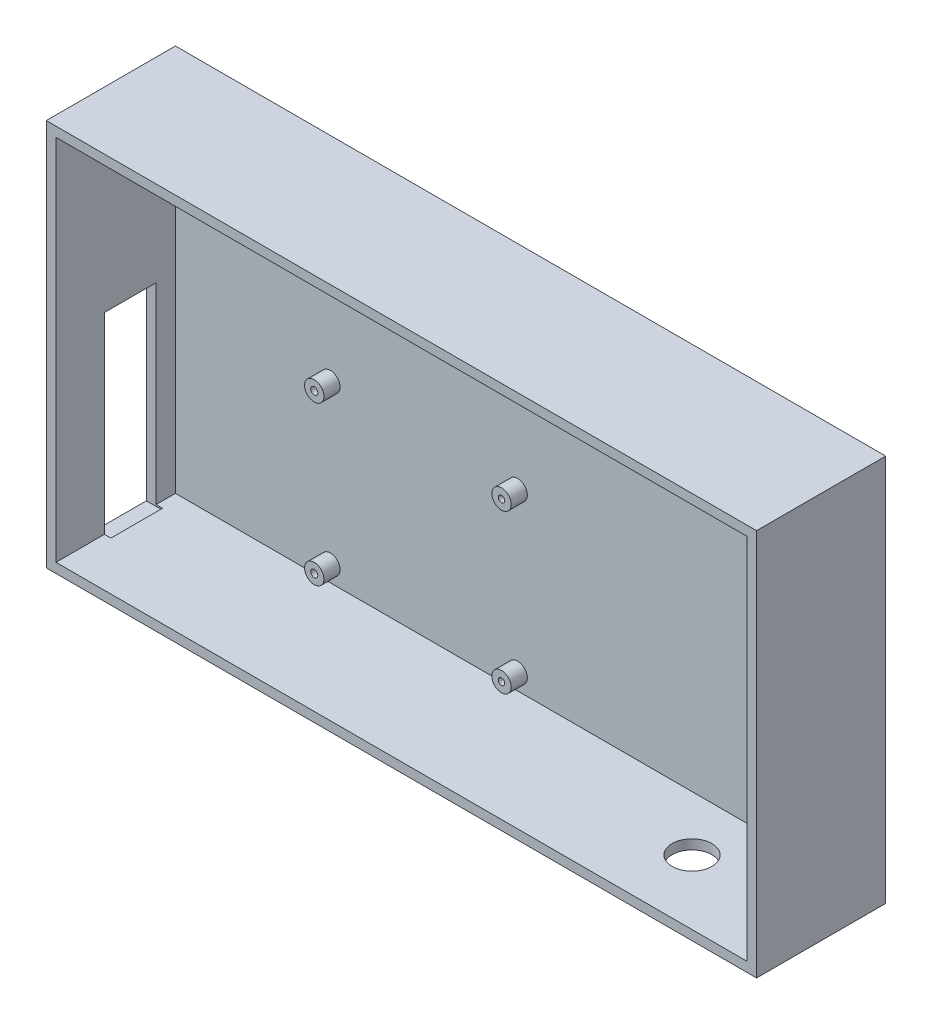
from build123d import *

# Parameters (mm, degrees)
SKETCH_1_W          = 220
SKETCH_1_H          = 120
ENCLOSURE_DEPTH     = 40
CAVITY_START        = 3
SKETCH_2_W          = 214
SKETCH_2_H          = 114
CAVITY_DEPTH        = 37
SKETCH_3_R          = 3
STANDOFF_DEPTH      = 8
STANDOFFHOLE_START  = 3
SKETCH_4_R          = 1.1
STANDOFFHOLE_DEPTH  = 5
SKETCH_5_R          = 3
EXTRUDE_3_DEPTH     = 8
CUT_EXTRUDE_START   = 3
SKETCH_6_R          = 1.1
CUT_EXTRUDE_3_DEPTH = 5
SKETCH_7_R          = 3
EXTRUDE_4_DEPTH     = 8
SKETCH_8_R          = 1
CUT_EXTRUDE_4_DEPTH = 5
SKETCH_9_R          = 3
EXTRUDE_5_DEPTH     = 8
SKETCH_10_R         = 1
CUT_EXTRUDE_5_DEPTH = 5
SKETCH_11_R         = 6.15
BUTTONHOLE_DEPTH    = 61
PORT_START          = 9
SKETCH_12_W         = 7
SKETCH_12_H         = 60
PORT_DEPTH          = 16


with BuildPart() as part:
    # 草图1 → Enclosure (new body)
    with BuildSketch(Plane.XY):
        Rectangle(SKETCH_1_W, SKETCH_1_H)
    extrude(amount=ENCLOSURE_DEPTH)

    # 草图2 → Cavity (cut)
    with BuildSketch(Plane.XY.offset(CAVITY_START)):
        Rectangle(SKETCH_2_W, SKETCH_2_H)
    extrude(amount=CAVITY_DEPTH, mode=Mode.SUBTRACT)

    # 草图3 → Standoff (add)
    with BuildSketch(Plane.XY):
        with Locations(Location((-59, -52, 0), (0, 0, 180))):
            Circle(SKETCH_3_R)
    extrude(amount=STANDOFF_DEPTH)

    # 草图4 → StandoffHole (cut)
    with BuildSketch(Plane.XY.offset(STANDOFFHOLE_START)):
        with Locations((-59, -52)):
            Circle(SKETCH_4_R)
    extrude(amount=STANDOFFHOLE_DEPTH, mode=Mode.SUBTRACT)

    # 草图5 → 凸台-拉伸3 (add)
    with BuildSketch(Plane.XY):
        with Locations(Location((-59, -3, 0), (0, 0, 180))):
            Circle(SKETCH_5_R)
    extrude(amount=EXTRUDE_3_DEPTH)

    # 草图6 → 切除-拉伸3 (cut)
    with BuildSketch(Plane.XY.offset(CUT_EXTRUDE_START)):
        with Locations((-59, -3)):
            Circle(SKETCH_6_R)
    extrude(amount=CUT_EXTRUDE_3_DEPTH, mode=Mode.SUBTRACT)

    # 草图7 → 凸台-拉伸4 (add)
    with BuildSketch(Plane.XY):
        with Locations(Location((-1, -52, 0), (0, 0, 180))):
            Circle(SKETCH_7_R)
    extrude(amount=EXTRUDE_4_DEPTH)

    # 草图8 → 切除-拉伸4 (cut)
    with BuildSketch(Plane.XY.offset(CUT_EXTRUDE_START)):
        with Locations((-1, -52)):
            Circle(SKETCH_8_R)
    extrude(amount=CUT_EXTRUDE_4_DEPTH, mode=Mode.SUBTRACT)

    # 草图9 → 凸台-拉伸5 (add)
    with BuildSketch(Plane.XY):
        with Locations(Location((-1, -3, 0), (0, 0, 180))):
            Circle(SKETCH_9_R)
    extrude(amount=EXTRUDE_5_DEPTH)

    # 草图10 → 切除-拉伸5 (cut)
    with BuildSketch(Plane.XY.offset(CUT_EXTRUDE_START)):
        with Locations((-1, -3)):
            Circle(SKETCH_10_R)
    extrude(amount=CUT_EXTRUDE_5_DEPTH, mode=Mode.SUBTRACT)

    # 草图11 → ButtonHole (cut)
    with BuildSketch(Plane(origin=(0, 0, 0), x_dir=(1, 0, 0), z_dir=(0, 1, 0))):
        with Locations(Location((70, -20, 0), (0, 0, 270))):
            Circle(SKETCH_11_R)
    extrude(amount=-BUTTONHOLE_DEPTH, mode=Mode.SUBTRACT)

    # 草图12 → Port (cut)
    with BuildSketch(Plane.XY.offset(PORT_START)):
        with Locations((-108.5, -27.5)):
            Rectangle(SKETCH_12_W, SKETCH_12_H)
    extrude(amount=PORT_DEPTH, mode=Mode.SUBTRACT)


solid = part.part
